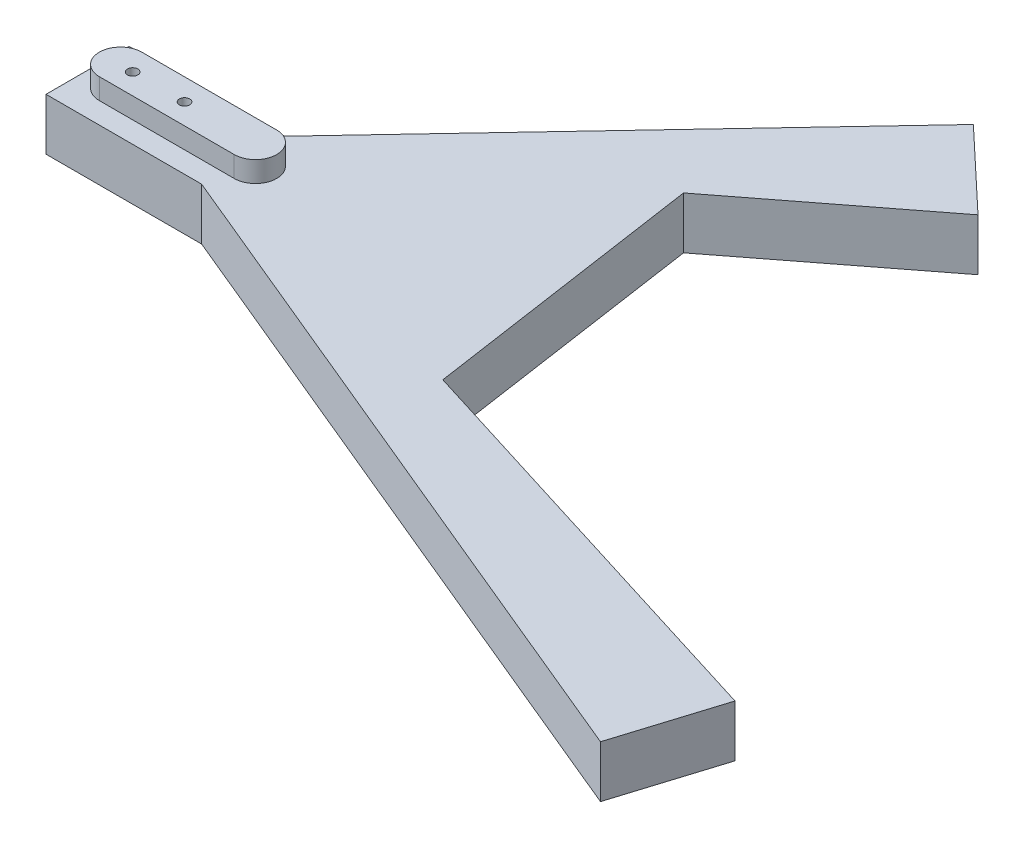
from build123d import *

# Parameters (mm, degrees)
SKETCH1_W           = 30
SKETCH1_H           = 16
BOSS_EXTRUDE1_DEPTH = 10
BOSS_EXTRUDE2_DEPTH = 4
SKETCH3_R           = 1
CUT_EXTRUDE1_DEPTH  = 20


with BuildPart() as part:
    # Sketch1 → Boss-Extrude1 (new body)
    with BuildSketch(Plane(origin=(0, 0, 0), x_dir=(1, 0, 0), z_dir=(0, 1, 0))):
        Polygon((83.598365037, 72.861095688), (19.188679245, 4.528301887), (19.188679245, -3.471698113), (67.093699226, 33.50154619), (99.126439745, 58.224515545), align=None)
        Polygon((75.084307937, -20.878636135), (19.188679245, -3.471698113), (19.188679245, -11.471698113), (150.692912318, -66.106409411), (156.848103065, -46.341402143), align=None)
        with Locations((4.188679245, -3.471698113)):
            Rectangle(SKETCH1_W, SKETCH1_H)
        Polygon((67.093699226, 33.50154619), (19.188679245, -3.471698113), (75.084307937, -20.878636135), align=None)
    extrude(amount=BOSS_EXTRUDE1_DEPTH)

    # Sketch2 → Boss-Extrude2 (add)
    with BuildSketch(Plane(origin=(0, 10, 0), x_dir=(1, 0, 0), z_dir=(0, 1, 0))):
        with BuildLine():
            Line((-4.616424759, 0.799624641), (21.383575241, 0.799624641))
            ThreePointArc((21.383575241, 0.799624641), (25.477598736, -3.294398854), (21.383575241, -7.38842235))
            Line((21.383575241, -7.38842235), (-4.616424759, -7.38842235))
            ThreePointArc((-4.616424759, -7.38842235), (-8.710448255, -3.294398854), (-4.616424759, 0.799624641))
        make_face()
    extrude(amount=BOSS_EXTRUDE2_DEPTH)

    # Sketch3 → Cut-Extrude1 (cut)
    with BuildSketch(Plane(origin=(0, 14, 0), x_dir=(1, 0, 0), z_dir=(0, 1, 0))):
        with Locations(Location((-2.189535813, -3.38842235, 0), (0, 0, 270))):
            Circle(SKETCH3_R)
        with Locations(Location((7.810464187, -3.394168988, 0), (0, 0, 270))):
            Circle(SKETCH3_R)
    extrude(amount=-CUT_EXTRUDE1_DEPTH, mode=Mode.SUBTRACT)


solid = part.part
